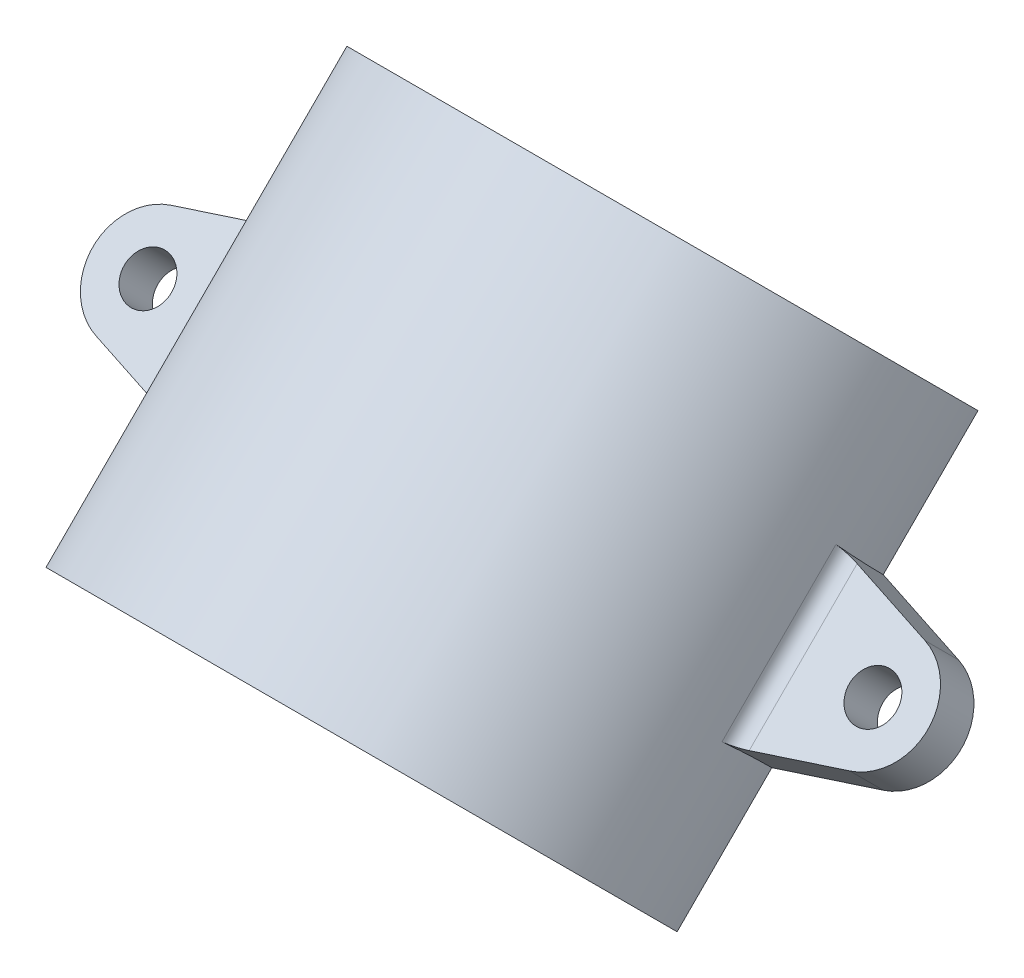
from build123d import *

# Parameters (mm, degrees)
BOSS_EXTRUDE1_DEPTH = 27
SKETCH2_R           = 1.5
BOSS_EXTRUDE2_DEPTH = 3
FILLET1_R           = 1


with BuildPart() as part:
    # Sketch1 → Boss-Extrude1 (new body)
    with BuildSketch(Plane(origin=(0, 64.224437766, -64.224437766), x_dir=(1, 0, 0), z_dir=(0, 0.7071067811865498, -0.7071067811865452))):
        with BuildLine():
            Line((91.844609768, -130.551114539), (88.844609768, -130.551114539))
            ThreePointArc((88.844609768, -130.551114539), (73.844609768, -145.551114539), (58.844609768, -130.551114539))
            Line((58.844609768, -130.551114539), (55.844609768, -130.551114539))
            ThreePointArc((55.844609768, -130.551114539), (73.844609768, -148.551114539), (91.844609768, -130.551114539))
        make_face()
    extrude(amount=-BOSS_EXTRUDE1_DEPTH)

    # Sketch2 → Boss-Extrude2 (add)
    # profile 1 of 2: a face of its own
    with BuildSketch(Plane(origin=(0, 92.313578382, 92.313578382), x_dir=(1, 0, 0), z_dir=(-1.3084103822363938e-14, 0.7071067811865454, 0.7071067811865497))):
        with BuildLine():
            Line((97.77004577, 80.702506927), (88.844609768, 83.149574448))
            Line((88.844609768, 83.149574448), (88.844609768, 71.5045674))
            Line((88.844609768, 71.5045674), (97.77004577, 73.951634922))
            ThreePointArc((97.77004577, 73.951634922), (100.344609768, 77.327070924), (97.77004577, 80.702506927))
        make_face()
        with Locations(Location((96.844609768, 77.327070924, 0), (0, 0, 270))):
            Circle(SKETCH2_R, mode=Mode.SUBTRACT)
    # profile 2 of 2: a face of its own
    with BuildSketch(Plane(origin=(0, 92.313578382, 92.313578382), x_dir=(1, 0, 0), z_dir=(-1.3084103822363938e-14, 0.7071067811865454, 0.7071067811865497))):
        with BuildLine():
            Line((49.919173765, 73.951634922), (58.844609768, 71.5045674))
            Line((58.844609768, 71.5045674), (58.844609768, 83.149574448))
            Line((58.844609768, 83.149574448), (49.919173765, 80.702506927))
            ThreePointArc((49.919173765, 80.702506927), (47.344609768, 77.327070924), (49.919173765, 73.951634922))
        make_face()
        with Locations(Location((50.844609768, 77.327070924, 0), (0, 0, 270))):
            Circle(SKETCH2_R, mode=Mode.SUBTRACT)
    extrude(amount=BOSS_EXTRUDE2_DEPTH)

    # Fillet1
    fillet1_edges = [part.edges().sort_by_distance(p)[0] for p in [
        (91.592849117, 149.113394945, 39.756402505),
        (56.096370418, 149.113394945, 39.756402505),
    ]]
    fillet(fillet1_edges, radius=FILLET1_R)


solid = part.part
